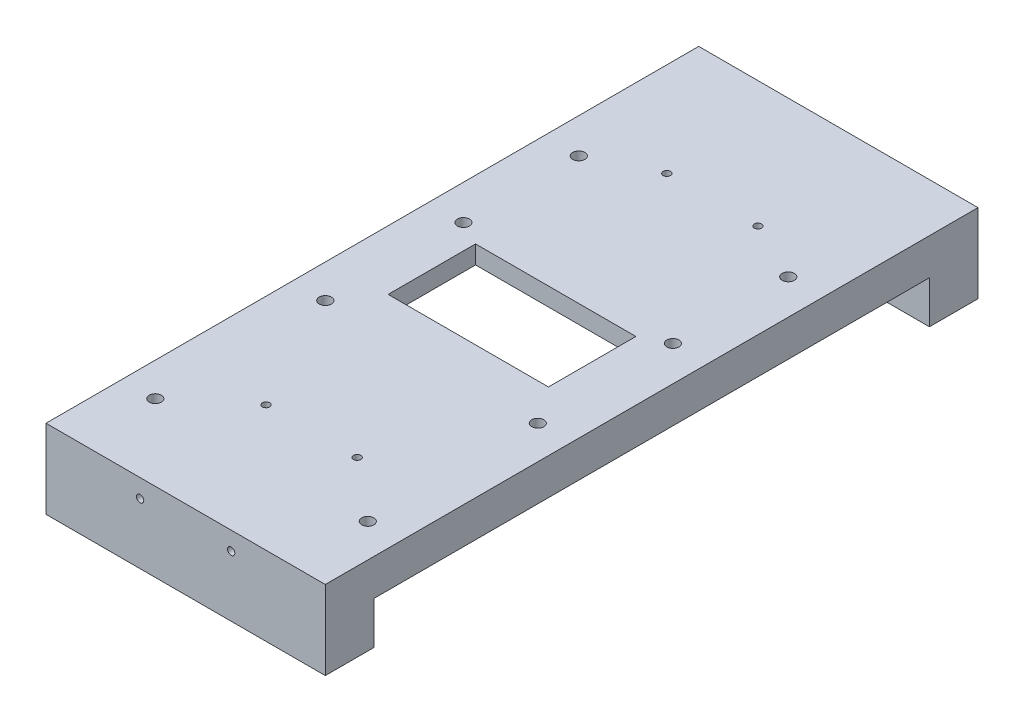
from build123d import *

# Parameters (mm, degrees)
SKETCH_4_W           = 46
SKETCH_4_H           = 107.5
EXTRUDE_1_DEPTH      = 3
SKETCH_5_W           = 23.5
SKETCH_5_H           = 56
EXTRUDE_2_DEPTH      = 12.4
SKETCH_6_R           = 1.75
SKETCH_6_R_2         = 0.75
CUT_EXTRUDE_1_DEPTH  = 66.1949768
SKETCH_6_3_R         = 3
CUT_EXTRUDE_2_DEPTH  = 2.7
CUT_EXTRUDE_START    = -20.8
SKETCH_6_4_R         = 3
CUT_EXTRUDE_3_DEPTH  = 2.7
SKETCH_6_5_R         = 1.5
CUT_EXTRUDE_4_DEPTH  = 1.2
CUT_EXTRUDE_START_2  = -22.3
SKETCH_6_6_R         = 1.5
CUT_EXTRUDE_5_DEPTH  = 1.2
SKETCH_7_R           = 0.7
CUT_EXTRUDE_6_DEPTH  = 2
CUT_EXTRUDE_START_3  = -2
SKETCH_8_W           = 16.4
SKETCH_8_H           = 14.4
CUT_EXTRUDE_7_DEPTH  = 59.458436136
SKETCH_9_W           = 46
SKETCH_9_H           = 8
EXTRUDE_3_DEPTH      = 10
SKETCH_9_3_W         = 3
SKETCH_9_3_H         = 91.5
EXTRUDE_4_DEPTH      = 3
SKETCH_10_R          = 0.6
CUT_EXTRUDE_8_DEPTH  = 2
SKETCH_11_W          = 26.4
SKETCH_11_H          = 14.4
CUT_EXTRUDE_9_DEPTH  = 5
SKETCH_12_R          = 0.5
CUT_EXTRUDE_10_DEPTH = 2
CUT_EXTRUDE_11_DEPTH = 61.458436136
SKETCH_15_R          = 0.6
CUT_EXTRUDE_13_DEPTH = 60.764726219
SKETCH_14_W          = 23.5
SKETCH_14_H          = 12.4
CUT_EXTRUDE_12_DEPTH = 56
SKETCH_16_R          = 1
CUT_EXTRUDE_14_DEPTH = 60.313257371
SKETCH_16_3_R        = 1.5
SKETCH_16_3_R_2      = 1
CUT_EXTRUDE_15_DEPTH = 1
SKETCH_17_R          = 1
CUT_EXTRUDE_16_DEPTH = 60.313257371
SKETCH_18_R          = 1.5
CUT_EXTRUDE_17_DEPTH = 1


with BuildPart() as part:
    # 草图4 → 凸台-拉伸1 (new body)
    with BuildSketch(Plane(origin=(0, 0, 0), x_dir=(1, 0, 0), z_dir=(0, 1, 0))):
        Rectangle(SKETCH_4_W, SKETCH_4_H)
    extrude(amount=EXTRUDE_1_DEPTH)

    # 草图5 → 凸台-拉伸2 (add)
    with BuildSketch(Plane.XZ):
        Rectangle(SKETCH_5_W, SKETCH_5_H)
    extrude(amount=EXTRUDE_2_DEPTH)

    # 草图6 → 切除-拉伸1 (cut, through all)
    with BuildSketch(Plane.ZY.offset(11.75)):
        with Locations((0, -12.4)):
            Circle(SKETCH_6_R)
        with Locations((25, -12.4)):
            Circle(SKETCH_6_R_2)
        with Locations((-25, -12.4)):
            Circle(SKETCH_6_R_2)
    extrude(amount=-CUT_EXTRUDE_1_DEPTH, mode=Mode.SUBTRACT)

    # 草图6<3> → 切除-拉伸2 (cut)
    with BuildSketch(Plane.ZY.offset(11.75)):
        with Locations((0, -12.4)):
            Circle(SKETCH_6_3_R)
    extrude(amount=-CUT_EXTRUDE_2_DEPTH, mode=Mode.SUBTRACT)

    # 草图6<4> → 切除-拉伸3 (cut)
    with BuildSketch(Plane.ZY.offset(11.75).offset(CUT_EXTRUDE_START)):
        with Locations((0, -12.4)):
            Circle(SKETCH_6_4_R)
    extrude(amount=-CUT_EXTRUDE_3_DEPTH, mode=Mode.SUBTRACT)

    # 草图6<5> → 切除-拉伸4 (cut)
    with BuildSketch(Plane.ZY.offset(11.75)):
        with Locations((25, -12.4)):
            Circle(SKETCH_6_5_R)
        with Locations((-25, -12.4)):
            Circle(SKETCH_6_5_R)
    extrude(amount=-CUT_EXTRUDE_4_DEPTH, mode=Mode.SUBTRACT)

    # 草图6<6> → 切除-拉伸5 (cut)
    with BuildSketch(Plane.ZY.offset(11.75).offset(CUT_EXTRUDE_START_2)):
        with Locations((25, -12.4)):
            Circle(SKETCH_6_6_R)
        with Locations((-25, -12.4)):
            Circle(SKETCH_6_6_R)
    extrude(amount=-CUT_EXTRUDE_5_DEPTH, mode=Mode.SUBTRACT)

    # 草图7 → 切除-拉伸6 (cut)
    with BuildSketch(Plane(origin=(0, -12.4, 0), x_dir=(-1, 0, 0), z_dir=(0, -1, 0))):
        with Locations(Location((9.249949764, -20, 0), (0, 0, 90))):
            Circle(SKETCH_7_R)
        with Locations(Location((-9.249949764, -20, 0), (0, 0, 90))):
            Circle(SKETCH_7_R)
        with Locations(Location((-9.249949764, -6, 0), (0, 0, 90))):
            Circle(SKETCH_7_R)
        with Locations(Location((9.249949764, -6, 0), (0, 0, 90))):
            Circle(SKETCH_7_R)
        with Locations(Location((9.249949764, 6, 0), (0, 0, 90))):
            Circle(SKETCH_7_R)
        with Locations(Location((-9.249949764, 6, 0), (0, 0, 90))):
            Circle(SKETCH_7_R)
        with Locations(Location((-9.249949764, 20, 0), (0, 0, 90))):
            Circle(SKETCH_7_R)
        with Locations(Location((9.249949764, 20, 0), (0, 0, 90))):
            Circle(SKETCH_7_R)
    extrude(amount=-CUT_EXTRUDE_6_DEPTH, mode=Mode.SUBTRACT)

    # 草图8 → 切除-拉伸7 (cut, through all)
    with BuildSketch(Plane.XZ.offset(12.4).offset(CUT_EXTRUDE_START_3)):
        Rectangle(SKETCH_8_W, SKETCH_8_H)
    extrude(amount=-CUT_EXTRUDE_7_DEPTH, mode=Mode.SUBTRACT)

    # 草图9 → 凸台-拉伸3 (add)
    with BuildSketch(Plane.XZ):
        with Locations((0, 49.75)):
            Rectangle(SKETCH_9_W, SKETCH_9_H)
        with Locations((0, -49.75)):
            Rectangle(SKETCH_9_W, SKETCH_9_H)
    extrude(amount=EXTRUDE_3_DEPTH)

    # 草图9<3> → 凸台-拉伸4 (add)
    with BuildSketch(Plane.XZ):
        with Locations((-21.5, 0)):
            Rectangle(SKETCH_9_3_W, SKETCH_9_3_H)
        with Locations((21.5, 0)):
            Rectangle(SKETCH_9_3_W, SKETCH_9_3_H)
    extrude(amount=EXTRUDE_4_DEPTH)

    # 草图10 → 切除-拉伸8 (cut)
    with BuildSketch(Plane.XY.offset(53.75)):
        with Locations((-7.5, 0)):
            Circle(SKETCH_10_R)
        with Locations((7.5, 0)):
            Circle(SKETCH_10_R)
    extrude(amount=-CUT_EXTRUDE_8_DEPTH, mode=Mode.SUBTRACT)

    # 草图11 → 切除-拉伸9 (cut)
    with BuildSketch(Plane(origin=(0, 3, 0), x_dir=(1, 0, 0), z_dir=(0, 1, 0))):
        Rectangle(SKETCH_11_W, SKETCH_11_H)
    extrude(amount=-CUT_EXTRUDE_9_DEPTH, mode=Mode.SUBTRACT)

    # 草图12 → 切除-拉伸10 (cut)
    with BuildSketch(Plane(origin=(0, -2, 0), x_dir=(1, 0, 0), z_dir=(0, 1, 0))):
        with Locations(Location((-9.975, 0, 0), (0, 0, 270))):
            Circle(SKETCH_12_R)
        with Locations(Location((9.975, 0, 0), (0, 0, 270))):
            Circle(SKETCH_12_R)
    extrude(amount=-CUT_EXTRUDE_10_DEPTH, mode=Mode.SUBTRACT)

    # 草图13 → 切除-拉伸11 (cut, through all)
    with BuildSketch(Plane.XZ.offset(12.4)):
        Polygon((-8.75, 2.6), (-6.75, 2.6), (-6.75, 5.75), (-3.55, 5.75), (-3.55, -5.75), (-6.75, -5.75), (-6.75, -2.6), (-8.75, -2.6), align=None)
    extrude(amount=-CUT_EXTRUDE_11_DEPTH, mode=Mode.SUBTRACT)

    # 草图15 → 切除-拉伸13 (cut, through all)
    with BuildSketch(Plane.XZ):
        with Locations(Location((-7.5, 33, 0), (0, 0, 270))):
            Circle(SKETCH_15_R)
        with Locations(Location((7.5, 33, 0), (0, 0, 270))):
            Circle(SKETCH_15_R)
        with Locations(Location((-7.5, -33, 0), (0, 0, 270))):
            Circle(SKETCH_15_R)
        with Locations(Location((7.5, -33, 0), (0, 0, 270))):
            Circle(SKETCH_15_R)
    extrude(amount=-CUT_EXTRUDE_13_DEPTH, mode=Mode.SUBTRACT)

    # 草图14 → 切除-拉伸12 (cut)
    with BuildSketch(Plane(origin=(0, 0, -28), x_dir=(-1, 0, 0), z_dir=(0, 0, -1))):
        with Locations((0, -6.2)):
            Rectangle(SKETCH_14_W, SKETCH_14_H)
    extrude(amount=-CUT_EXTRUDE_12_DEPTH, mode=Mode.SUBTRACT)

    # 草图16 → 切除-拉伸14 (cut, through all)
    with BuildSketch(Plane(origin=(0, 0, 0), x_dir=(-1, 0, 0), z_dir=(0, -1, 0))):
        with Locations(Location((17.25, 9.25, 0), (0, 0, 90))):
            Circle(SKETCH_16_R)
        with Locations(Location((17.25, 28.25, 0), (0, 0, 90))):
            Circle(SKETCH_16_R)
        with Locations(Location((-17.25, 28.25, 0), (0, 0, 90))):
            Circle(SKETCH_16_R)
        with Locations(Location((-17.25, 9.25, 0), (0, 0, 90))):
            Circle(SKETCH_16_R)
    extrude(amount=-CUT_EXTRUDE_14_DEPTH, mode=Mode.SUBTRACT)

    # 草图16<3> → 切除-拉伸15 (cut)
    # profile 1 of 4: a face of its own
    with BuildSketch(Plane(origin=(0, 0, 0), x_dir=(-1, 0, 0), z_dir=(0, -1, 0))):
        with Locations(Location((-17.25, 28.25, 0), (0, 0, 90))):
            Circle(SKETCH_16_3_R)
        with Locations(Location((-17.25, 28.25, 0), (0, 0, 90))):
            Circle(SKETCH_16_3_R_2, mode=Mode.SUBTRACT)
    # profile 2 of 4: a face of its own
    with BuildSketch(Plane(origin=(0, 0, 0), x_dir=(-1, 0, 0), z_dir=(0, -1, 0))):
        with Locations(Location((-17.25, 9.25, 0), (0, 0, 90))):
            Circle(SKETCH_16_3_R)
        with Locations(Location((-17.25, 9.25, 0), (0, 0, 90))):
            Circle(SKETCH_16_3_R_2, mode=Mode.SUBTRACT)
    # profile 3 of 4: a face of its own
    with BuildSketch(Plane(origin=(0, 0, 0), x_dir=(-1, 0, 0), z_dir=(0, -1, 0))):
        with Locations(Location((17.25, 9.25, 0), (0, 0, 90))):
            Circle(SKETCH_16_3_R)
        with Locations(Location((17.25, 9.25, 0), (0, 0, 90))):
            Circle(SKETCH_16_3_R_2, mode=Mode.SUBTRACT)
    # profile 4 of 4: a face of its own
    with BuildSketch(Plane(origin=(0, 0, 0), x_dir=(-1, 0, 0), z_dir=(0, -1, 0))):
        with Locations(Location((17.25, 28.25, 0), (0, 0, 90))):
            Circle(SKETCH_16_3_R)
        with Locations(Location((17.25, 28.25, 0), (0, 0, 90))):
            Circle(SKETCH_16_3_R_2, mode=Mode.SUBTRACT)
    extrude(amount=-CUT_EXTRUDE_15_DEPTH, mode=Mode.SUBTRACT)

    # 草图17 → 切除-拉伸16 (cut, through all)
    with BuildSketch(Plane.XZ):
        with Locations(Location((17.5, 41.25, 0), (0, 0, 270))):
            Circle(SKETCH_17_R)
        with Locations(Location((17.5, 13.25, 0), (0, 0, 270))):
            Circle(SKETCH_17_R)
        with Locations(Location((-17.5, 13.25, 0), (0, 0, 270))):
            Circle(SKETCH_17_R)
        with Locations(Location((-17.5, 41.25, 0), (0, 0, 270))):
            Circle(SKETCH_17_R)
    extrude(amount=-CUT_EXTRUDE_16_DEPTH, mode=Mode.SUBTRACT)

    # 草图18 → 切除-拉伸17 (cut)
    with BuildSketch(Plane.XZ):
        with Locations(Location((-17.5, 13.25, 0), (0, 0, 270))):
            Circle(SKETCH_18_R)
        with Locations(Location((17.5, 13.25, 0), (0, 0, 270))):
            Circle(SKETCH_18_R)
        with Locations(Location((17.5, 41.25, 0), (0, 0, 270))):
            Circle(SKETCH_18_R)
        with Locations(Location((-17.5, 41.25, 0), (0, 0, 270))):
            Circle(SKETCH_18_R)
    extrude(amount=-CUT_EXTRUDE_17_DEPTH, mode=Mode.SUBTRACT)


solid = part.part
